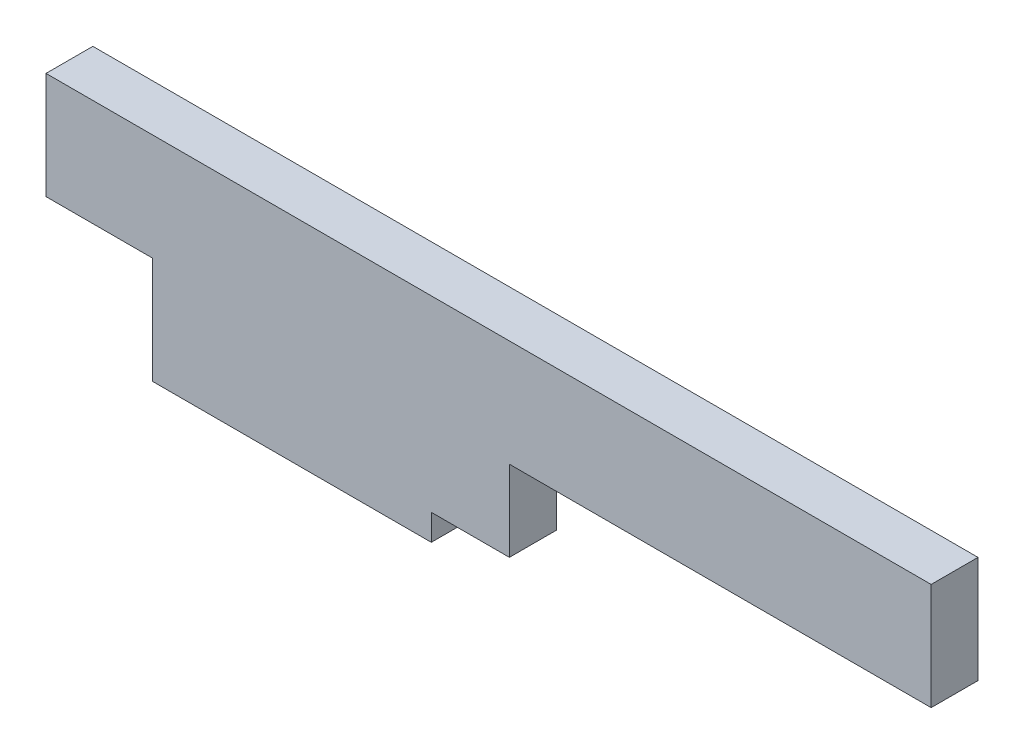
from build123d import *

# Parameters (mm, degrees)
BOSS_EXTRUDE1_DEPTH = 9


with BuildPart() as part:
    # Sketch1 → Boss-Extrude1 (new body)
    with BuildSketch(Plane.XY):
        Polygon((-85, 18.585209003), (85, 18.585209003), (85, -1.914790997), (4, -1.914790997), (4, -17.414790997), (-11, -17.414790997), (-11, -22.414790997), (-64.5, -22.414790997), (-64.5, -1.914790997), (-85, -1.914790997), align=None)
    extrude(amount=BOSS_EXTRUDE1_DEPTH)


solid = part.part
